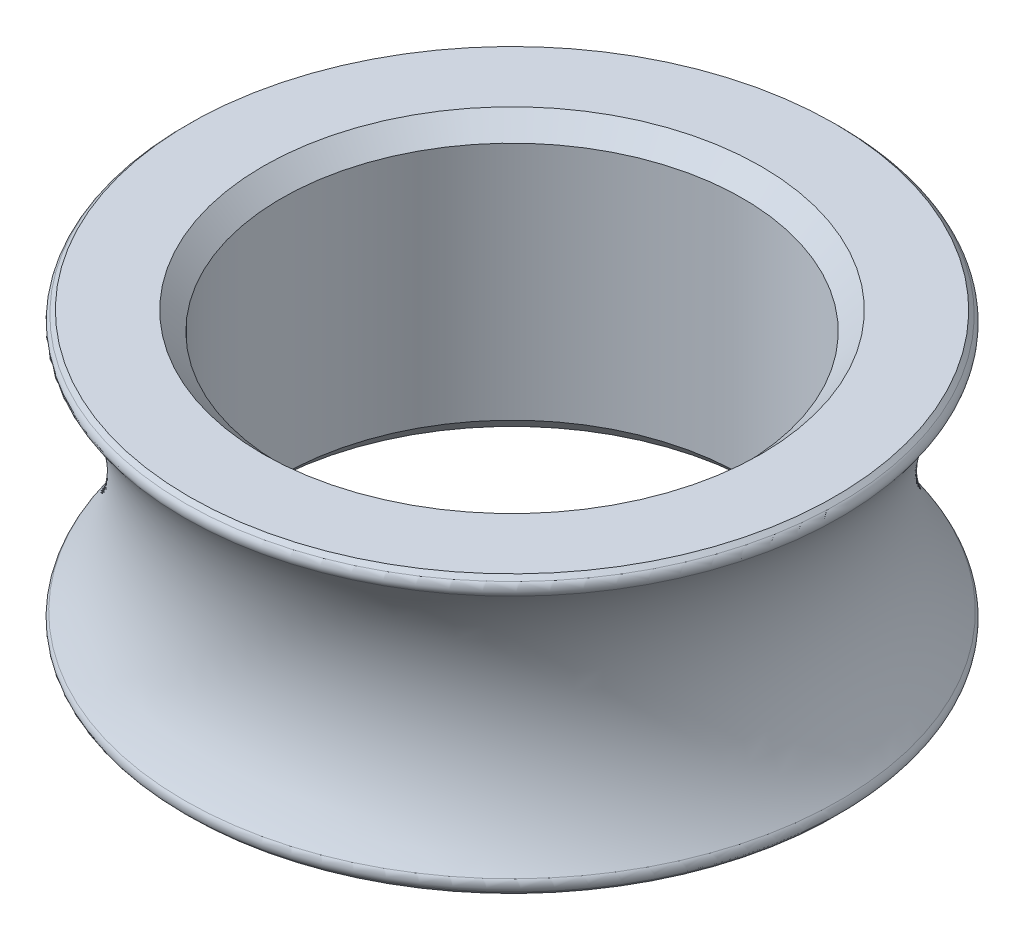
from build123d import *
from OCP.BRepFilletAPI import BRepFilletAPI_MakeChamfer

# Parameters (mm, degrees)
SKETCH1_R           = 3.7
SKETCH1_R_2         = 2.5
BOSS_EXTRUDE1_DEPTH = 1.5
CHAMFER1_SIZE       = 0.2
CHAMFER1_SIZE2      = 0.14146341463414658
CHAMFER2_SIZE       = 0.2
CHAMFER2_SIZE2      = 0.14146341463414658
FILLET1_R           = 0.1


with BuildPart() as part:
    # Sketch1 → Boss-Extrude1 (new, symmetric)
    with BuildSketch(Plane(origin=(0, 0, 0), x_dir=(1, 0, 0), z_dir=(0, 1, 0))):
        with Locations(Location((0, 0, 0), (0, 0, 270))):
            Circle(SKETCH1_R)
        with Locations(Location((0, 0, 0), (0, 0, 270))):
            Circle(SKETCH1_R_2, mode=Mode.SUBTRACT)
    extrude(amount=BOSS_EXTRUDE1_DEPTH, both=True)

    # Cut-Sweep1: sweep along a curve in space
    with BuildLine() as cut_sweep1_path:
        ThreePointArc((0, 1.5, 3.7), (2.6162950903902256, 1.5, 2.616295090390226), (3.7, 1.5, 0))
        ThreePointArc((3.7, 1.5, 0), (2.616295090390226, 1.5, -2.6162950903902256), (0, 1.5, -3.7))
        ThreePointArc((0, 1.5, -3.7), (-2.6162950903902256, 1.5, -2.616295090390226), (-3.7, 1.5, 0))
        ThreePointArc((-3.7, 1.5, 0), (-2.616295090390226, 1.5, 2.6162950903902256), (0, 1.5, 3.7))
    # Sketch2 → Cut-Sweep1 (sweep, cut)
    with BuildSketch(Plane(origin=(0, 0, 0), x_dir=(0, 0, -1), z_dir=(1, 0, 0))):
        with BuildLine():
            Line((-3.7, -1.5), (-3.7, 1.5))
            ThreePointArc((-3.7, 1.5), (-3.099999999999999, -3.3e-16), (-3.7, -1.5))
        make_face()
    sweep(path=cut_sweep1_path.line, mode=Mode.SUBTRACT)

    # Chamfer1: one chamfer whose edges measure the first distance from different faces: ONE call of the kernel's chamfer builder (chamfer() names one face for all edges)
    chamfer1_edges_1 = [part.edges().sort_by_distance(p)[0] for p in [
        (7.7e-16, -1.5, -2.5),
        (7.7e-16, 1.5, -2.5),
    ]]
    chamfer1_edges_2 = [part.edges().sort_by_distance(p)[0] for p in [
        (3.700000000000001, -1.5, 7e-16),
    ]]
    chamfer1_side_2 = [part.faces().sort_by_distance(p)[0] for p in [
        (3.595348196384392, -1.5, 6.7e-16),
    ]]
    chamfer1 = BRepFilletAPI_MakeChamfer(part.part.solid().wrapped)
    for e in chamfer1_edges_1:
        chamfer1.Add(CHAMFER1_SIZE, e.wrapped)
    for e in chamfer1_edges_2:
        chamfer1.Add(CHAMFER1_SIZE, CHAMFER1_SIZE2, e.wrapped, chamfer1_side_2[0].wrapped)  # the first distance lies on this face
    add(Compound.cast(chamfer1.Shape()), mode=Mode.REPLACE)

    # Chamfer2
    chamfer2_edges = [part.edges().sort_by_distance(p)[0] for p in [
        (3.700000000000001, 1.5, 7e-16),
    ]]
    chamfer2_side = [part.faces().sort_by_distance(p)[0] for p in [
        (8.6e-16, 1.5, -2.8046518036156094),
    ]]
    chamfer(chamfer2_edges, length=CHAMFER2_SIZE, length2=CHAMFER2_SIZE2, reference=chamfer2_side[0])

    # Fillet1
    fillet1_edges = [part.edges().sort_by_distance(p)[0] for p in [
        (3.6058210568322178, 1.394442443584041, 8.37383e-12),
        (3.605821056832176, -1.3944424435840415, -2.9301e-13),
    ]]
    fillet(fillet1_edges, radius=FILLET1_R)


solid = part.part
